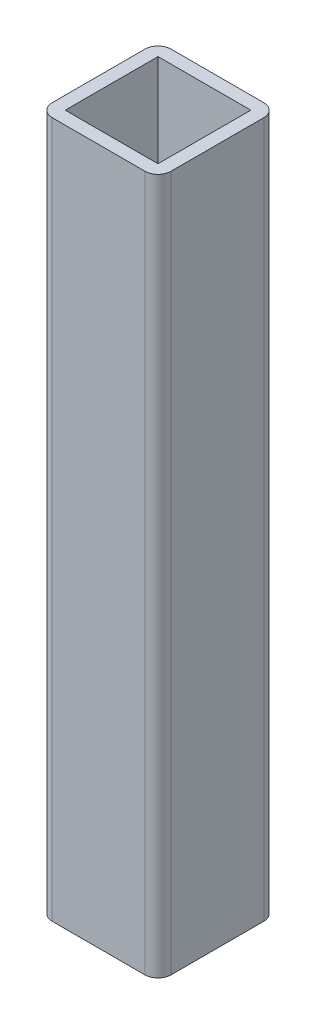
from build123d import *

# Parameters (mm, degrees)
BOSS_EXTRUDE1_DEPTH = 150
SKETCH3_W           = 20
SKETCH3_H           = 20
CUT_EXTRUDE1_DEPTH  = 1040.5


with BuildPart() as part:
    # Sketch1 → Boss-Extrude1 (new body)
    with BuildSketch(Plane(origin=(0, 0, 0), x_dir=(1, 0, 0), z_dir=(0, 1, 0))):
        with BuildLine():
            Line((2.8, 0), (22.8, 0))
            ThreePointArc((22.8, 0), (24.779898987, -0.820101013), (25.6, -2.8))
            Line((25.6, -2.8), (25.6, -22.8))
            ThreePointArc((25.6, -22.8), (24.779898987, -24.779898987), (22.8, -25.6))
            Line((22.8, -25.6), (2.8, -25.6))
            ThreePointArc((2.8, -25.6), (0.820101013, -24.779898987), (0, -22.8))
            Line((0, -22.8), (0, -2.8))
            ThreePointArc((0, -2.8), (0.820101013, -0.820101013), (2.8, 0))
        make_face()
    extrude(amount=BOSS_EXTRUDE1_DEPTH)

    # Sketch3 → Cut-Extrude1 (cut)
    with BuildSketch(Plane(origin=(0, 0, 0), x_dir=(-1, 0, 0), z_dir=(0, -1, 0))):
        with Locations((-12.8, -12.8)):
            Rectangle(SKETCH3_W, SKETCH3_H)
    extrude(amount=-CUT_EXTRUDE1_DEPTH, mode=Mode.SUBTRACT)


solid = part.part
